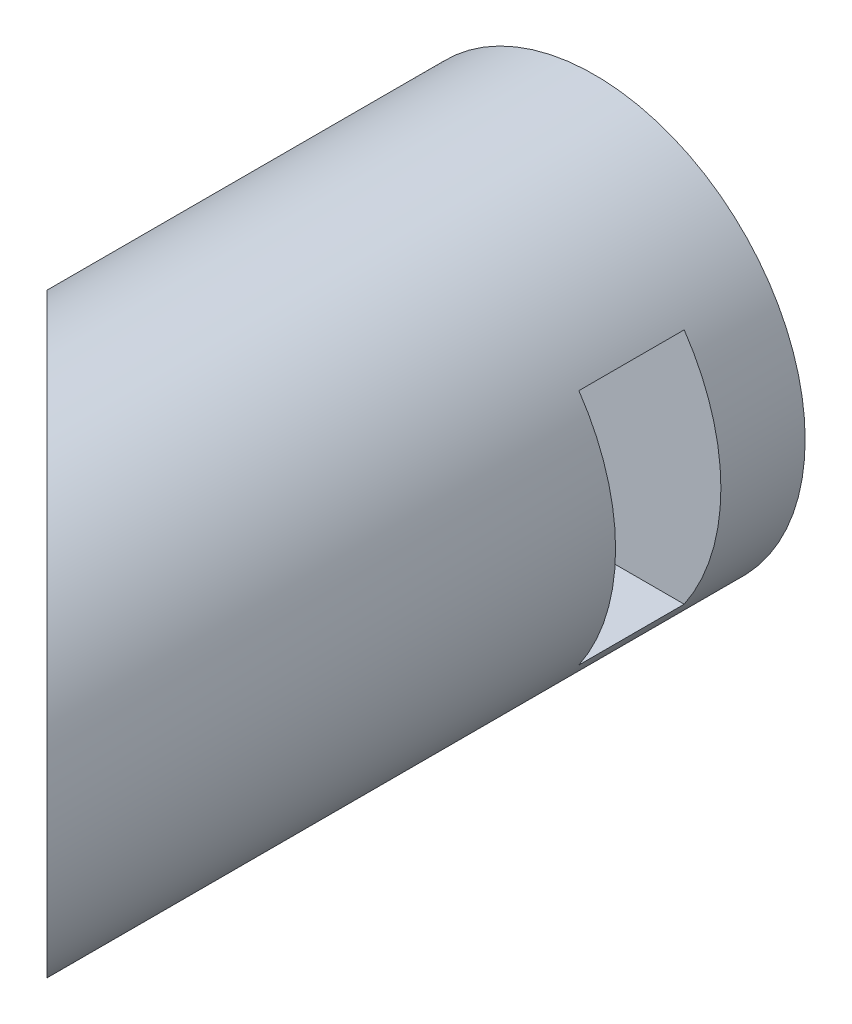
from build123d import *

# Parameters (mm, degrees)
SZKIC1_R                        = 5
DODANIE_WYCI_GNI_CIE1_DEPTH     = 18
WYTNIJ_WYCI_GNI_CIE1_DEPTH      = 5
WYTNIJ_WYCI_GNI_CIE1_DEPTH_BACK = 5
WYTNIJ_WYCI_GNI_CIE2_DEPTH      = 5
WYTNIJ_WYCI_GNI_CIE2_DEPTH_BACK = 3
SZKIC3_W                        = 2.5
SZKIC3_H                        = 5.64
WYTNIJ_WYCI_GNI_CIE3_REACH      = 21.339
SZKIC4_R                        = 1.6
WYTNIJ_WYCI_GNI_CIE4_DEPTH      = 2.5


with BuildPart() as part:
    # Szkic1 → Dodanie-wyciągnięcie1 (new body)
    with BuildSketch(Plane.XY):
        Circle(SZKIC1_R)
    extrude(amount=DODANIE_WYCI_GNI_CIE1_DEPTH)

    # Szkic2 → Wytnij-wyciągnięcie1 (cut, two sides: drawn at the far end of the back side and taken through both)
    with BuildSketch(Plane(origin=(0, 0, 0), x_dir=(1, 0, 0), z_dir=(0, 1, 0)).offset(-WYTNIJ_WYCI_GNI_CIE1_DEPTH_BACK)):
        Polygon((-5, -18), (5, -18), (-5, -8), align=None)
    extrude(amount=WYTNIJ_WYCI_GNI_CIE1_DEPTH + WYTNIJ_WYCI_GNI_CIE1_DEPTH_BACK, mode=Mode.SUBTRACT)

    # Szkic3 → Wytnij-wyciągnięcie2 (cut, two sides: drawn at the far end of the back side and taken through both)
    with BuildSketch(Plane(origin=(0, 0, 0), x_dir=(0, 0, -1), z_dir=(1, 0, 0)).offset(-WYTNIJ_WYCI_GNI_CIE2_DEPTH_BACK)):
        with Locations((-3.25, 0)):
            Rectangle(SZKIC3_W, SZKIC3_H)
    extrude(amount=WYTNIJ_WYCI_GNI_CIE2_DEPTH + WYTNIJ_WYCI_GNI_CIE2_DEPTH_BACK, mode=Mode.SUBTRACT)

    # Szkic4 → Wytnij-wyciągnięcie3 (cut, up to next)
    with BuildSketch(Plane(origin=(0, 0, 0), x_dir=(-1, 0, 0), z_dir=(0, 0, -1)), mode=Mode.PRIVATE) as wytnij_wyci_gni_cie3_sk1:
        Circle(SZKIC4_R)
    wytnij_wyci_gni_cie3_tool1 = extrude(wytnij_wyci_gni_cie3_sk1.sketch, amount=-WYTNIJ_WYCI_GNI_CIE3_REACH, mode=Mode.PRIVATE) & part.part
    add(wytnij_wyci_gni_cie3_tool1.solids().sort_by_distance((0, 0, 0))[0], mode=Mode.SUBTRACT)

    # Szkic5 → Wytnij-wyciągnięcie4 (cut)
    with BuildSketch(Plane.XY.offset(2)):
        Polygon((-3, -2.82), (-3, 2.82), (-4.333128401, 0), align=None)
    extrude(amount=WYTNIJ_WYCI_GNI_CIE4_DEPTH, mode=Mode.SUBTRACT)


solid = part.part
